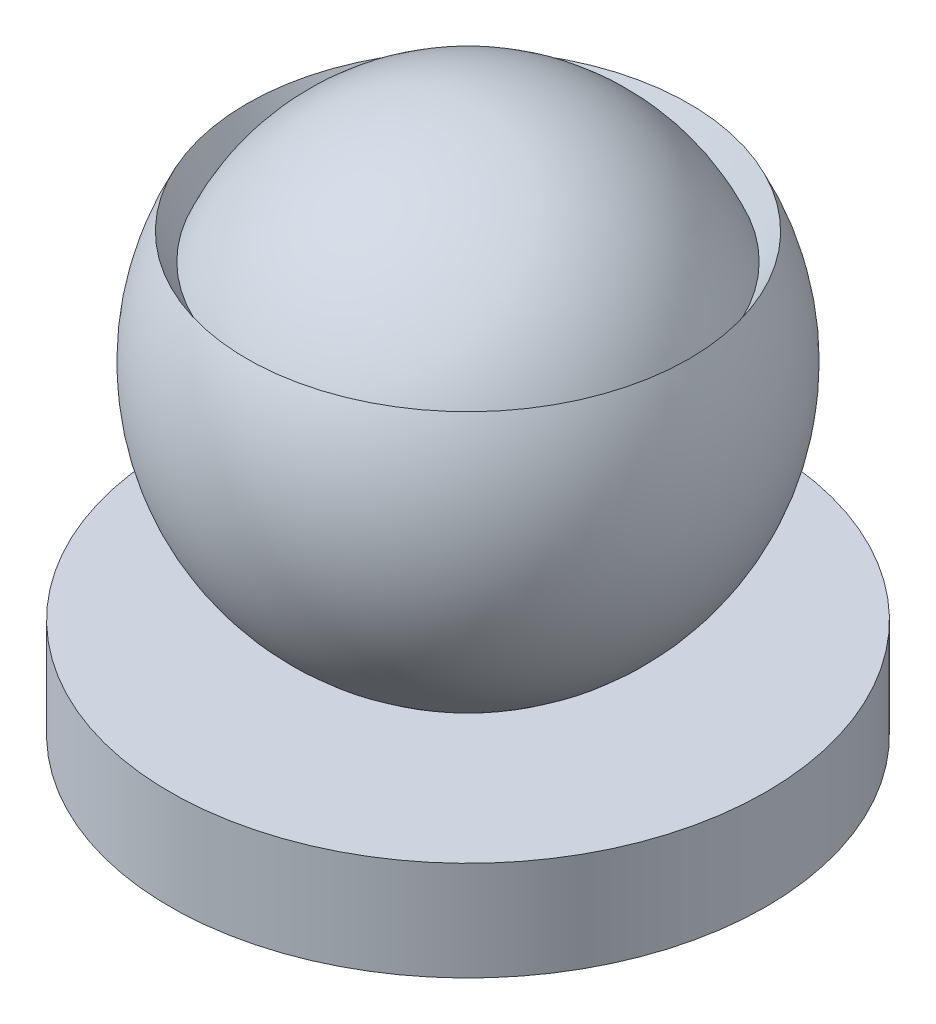
from build123d import *


with BuildPart() as part:
    # Sketch1 → Revolve1 (revolve)
    with BuildSketch(Plane.XY, mode=Mode.PRIVATE) as revolve1_sk:
        with BuildLine():
            Line((0, -13), (12, -13))
            Line((12, -13), (12, -9))
            Line((12, -9), (4.358898944, -9))
            ThreePointArc((4.358898944, -9), (9.481824462, -3.177263739), (8.901563091, 4.556552923))
            Line((8.901563091, 4.556552923), (8.291561976, 3.5))
            ThreePointArc((8.291561976, 3.5), (4.974937186, 7.5), (0, 9))
            Line((0, 9), (0, -13))
        make_face()
    revolve(revolve1_sk.sketch.rotate(Axis((0, 9, 0), (0, -1, 0)), 180), axis=Axis((0, 9, 0), (0, -1, 0)))


solid = part.part
